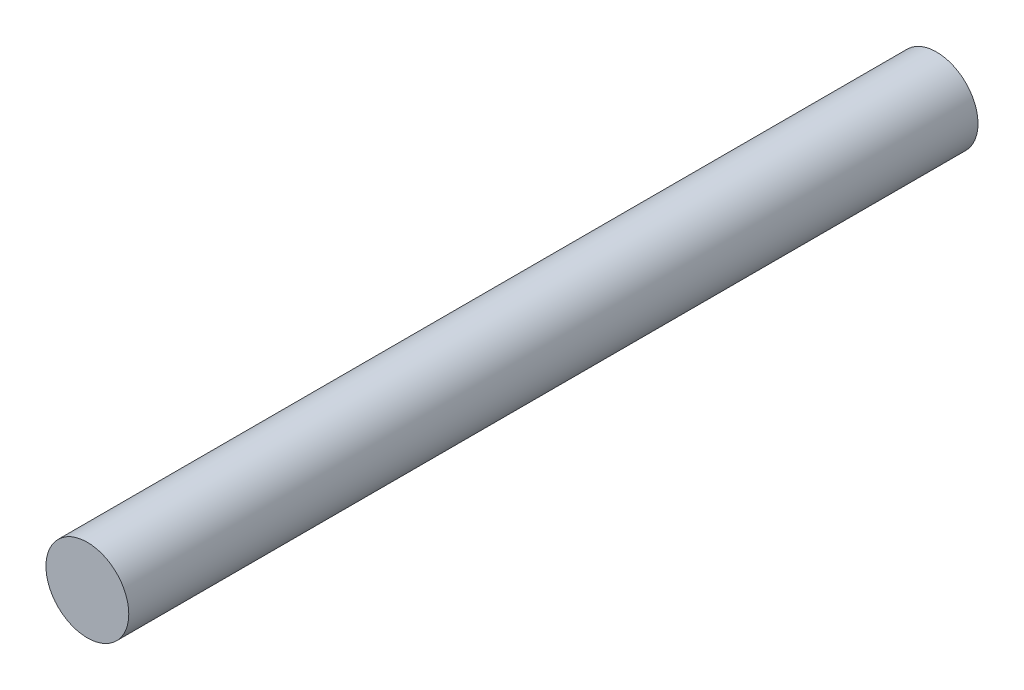
from build123d import *

# Parameters (mm, degrees)
ESBO_O1_R                = 4
RESSALTO_EXTRUS_O1_DEPTH = 82


with BuildPart() as part:
    # Esboço1 → Ressalto-extrusão1 (new body)
    with BuildSketch(Plane.XY):
        Circle(ESBO_O1_R)
    extrude(amount=RESSALTO_EXTRUS_O1_DEPTH)


solid = part.part
